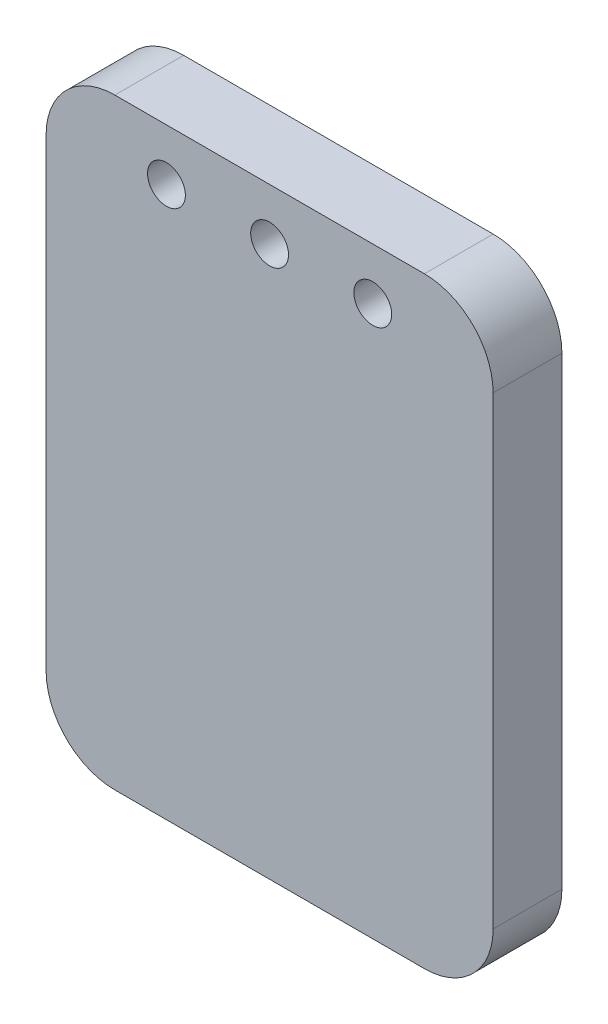
from build123d import *

# Parameters (mm, degrees)
SKETCH1_W           = 65
SKETCH1_H           = 87.5
SKETCH1_R           = 2.75
BOSS_EXTRUDE1_DEPTH = 10
FILLET1_R           = 10


with BuildPart() as part:
    # Sketch1 → Boss-Extrude1 (new body)
    with BuildSketch(Plane.XY):
        Rectangle(SKETCH1_W, SKETCH1_H)
        with Locations((-15, 36.25)):
            Circle(SKETCH1_R, mode=Mode.SUBTRACT)
        with Locations((0, 36.25)):
            Circle(SKETCH1_R, mode=Mode.SUBTRACT)
        with Locations((15, 36.25)):
            Circle(SKETCH1_R, mode=Mode.SUBTRACT)
    extrude(amount=BOSS_EXTRUDE1_DEPTH)

    # Fillet1
    fillet1_edges = [part.edges().sort_by_distance(p)[0] for p in [
        (-32.5, 43.75, 5),
        (32.5, 43.75, 5),
        (32.5, -43.75, 5),
        (-32.5, -43.75, 5),
    ]]
    fillet(fillet1_edges, radius=FILLET1_R)


solid = part.part
